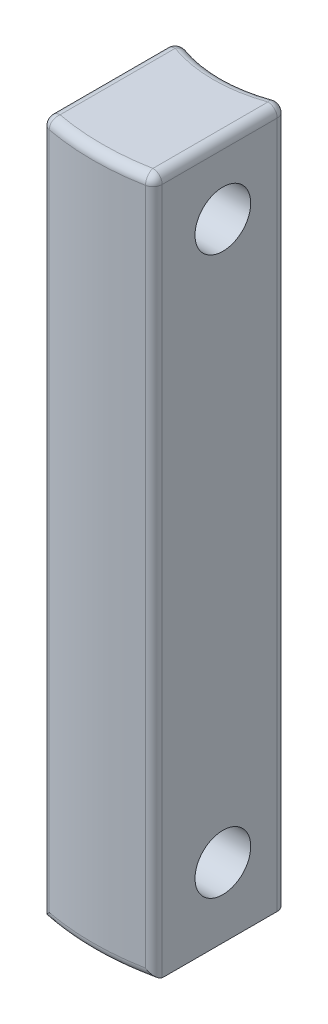
from build123d import *

# Parameters (mm, degrees)
BOSS_EXTRUDE1_DEPTH     = 37.5
CUT_EXTRUDE1_DEPTH      = 39.810570802
CUT_EXTRUDE1_DEPTH_BACK = 39.810570802
SKETCH2_R               = 3
FILLET1_R               = 1


with BuildPart() as part:
    # Sketch1 → Boss-Extrude1 (new, symmetric)
    with BuildSketch(Plane(origin=(0, 0, 0), x_dir=(1, 0, 0), z_dir=(0, 1, 0))):
        with BuildLine():
            Line((-6, 7.350239011), (-6, -7.350239011))
            ThreePointArc((-6, -7.350239011), (0, -8.000650348), (6, -7.350239011))
            Line((6, -7.350239011), (6, 7.350239011))
            ThreePointArc((6, 7.350239011), (0, 5.999349652), (-6, 7.350239011))
        make_face()
    extrude(amount=BOSS_EXTRUDE1_DEPTH, both=True)

    # Sketch2 → Cut-Extrude1 (cut, two sides: drawn at the far end of the back side and taken through both)
    with BuildSketch(Plane(origin=(0, 0, 0), x_dir=(0, 0, -1), z_dir=(1, 0, 0)).offset(-CUT_EXTRUDE1_DEPTH_BACK)):
        with Locations((0, 30)):
            Circle(SKETCH2_R)
        with Locations((0, -30)):
            Circle(SKETCH2_R)
    extrude(amount=CUT_EXTRUDE1_DEPTH + CUT_EXTRUDE1_DEPTH_BACK, mode=Mode.SUBTRACT)

    # Fillet1
    fillet1_edges = [part.edges().sort_by_distance(p)[0] for p in [
        (0, 37.5, 8.000650348),
        (6, 37.5, 0),
        (0, 37.5, -5.999349652),
        (0, -37.5, 8.000650348),
        (0, -37.5, -5.999349652),
        (6, 0, -7.350239011),
        (6, 0, 7.350239011),
        (-6, 0, 7.350239011),
        (-6, 0, -7.350239011),
        (-6, 37.5, 0),
    ]]
    fillet(fillet1_edges, radius=FILLET1_R)


solid = part.part
